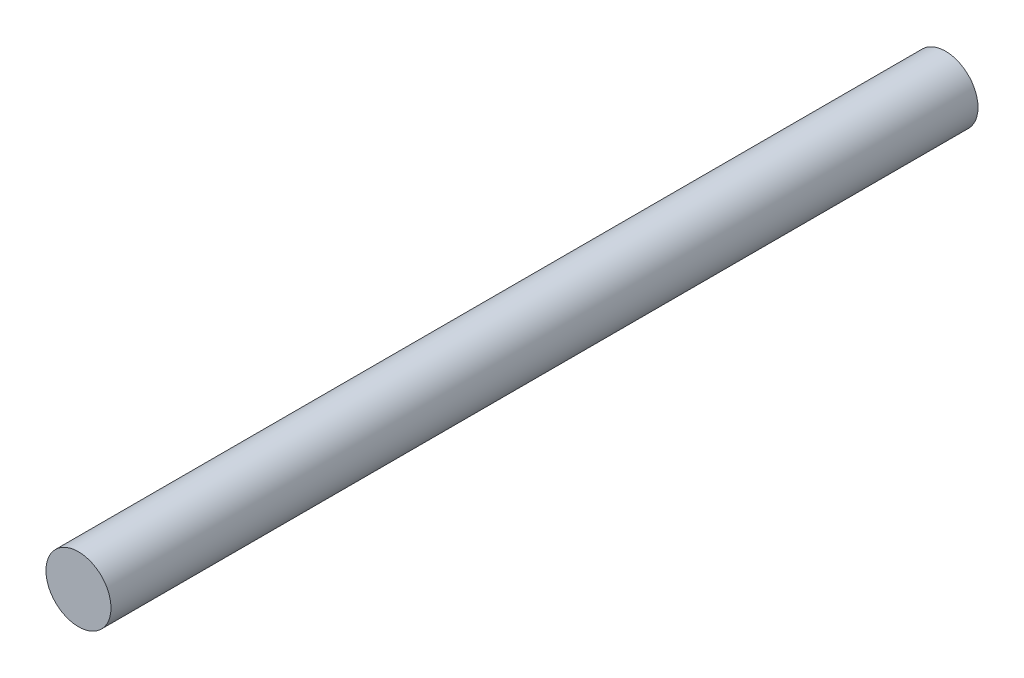
from build123d import *

# Parameters (mm, degrees)
SKETCH1_R                  = 1.5
SPRINT_BOSS_EXTRUDE1_DEPTH = 40


with BuildPart() as part:
    # Sketch1 → Sprint Boss-Extrude1 (new body)
    with BuildSketch(Plane.XY):
        Circle(SKETCH1_R)
    extrude(amount=SPRINT_BOSS_EXTRUDE1_DEPTH)


solid = part.part
